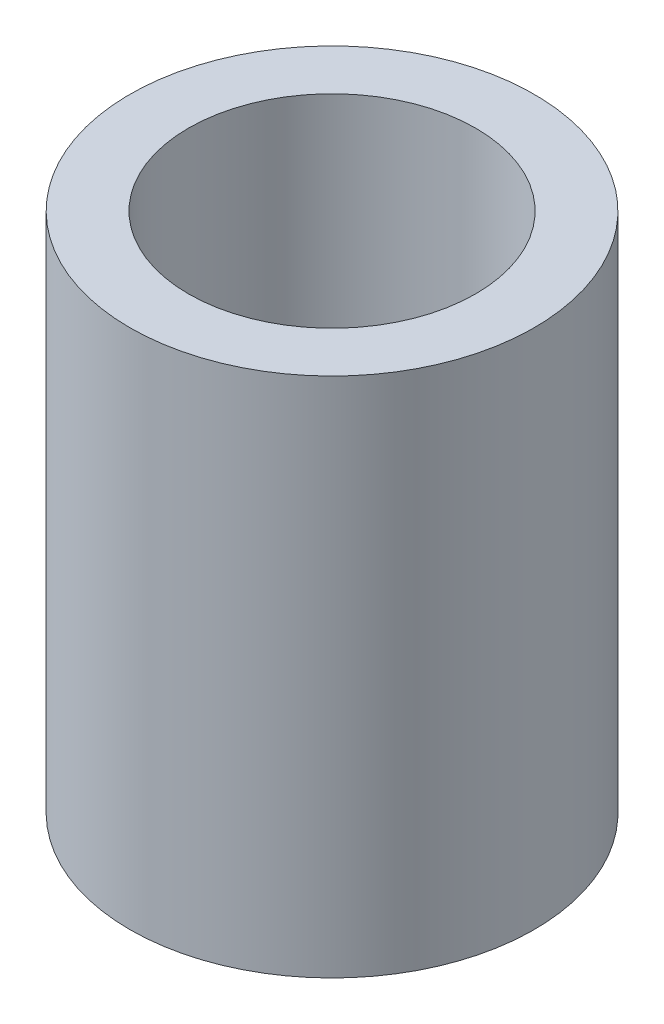
from build123d import *

# Parameters (mm, degrees)
SKETCH1_R           = 34.516408167
SKETCH1_R_2         = 24.516408167
BOSS_EXTRUDE2_DEPTH = 89


with BuildPart() as part:
    # Sketch1 → Boss-Extrude2 (new body)
    with BuildSketch(Plane(origin=(0, 0, 0), x_dir=(1, 0, 0), z_dir=(0, 1, 0))):
        Circle(SKETCH1_R)
        Circle(SKETCH1_R_2, mode=Mode.SUBTRACT)
    extrude(amount=BOSS_EXTRUDE2_DEPTH)


solid = part.part
